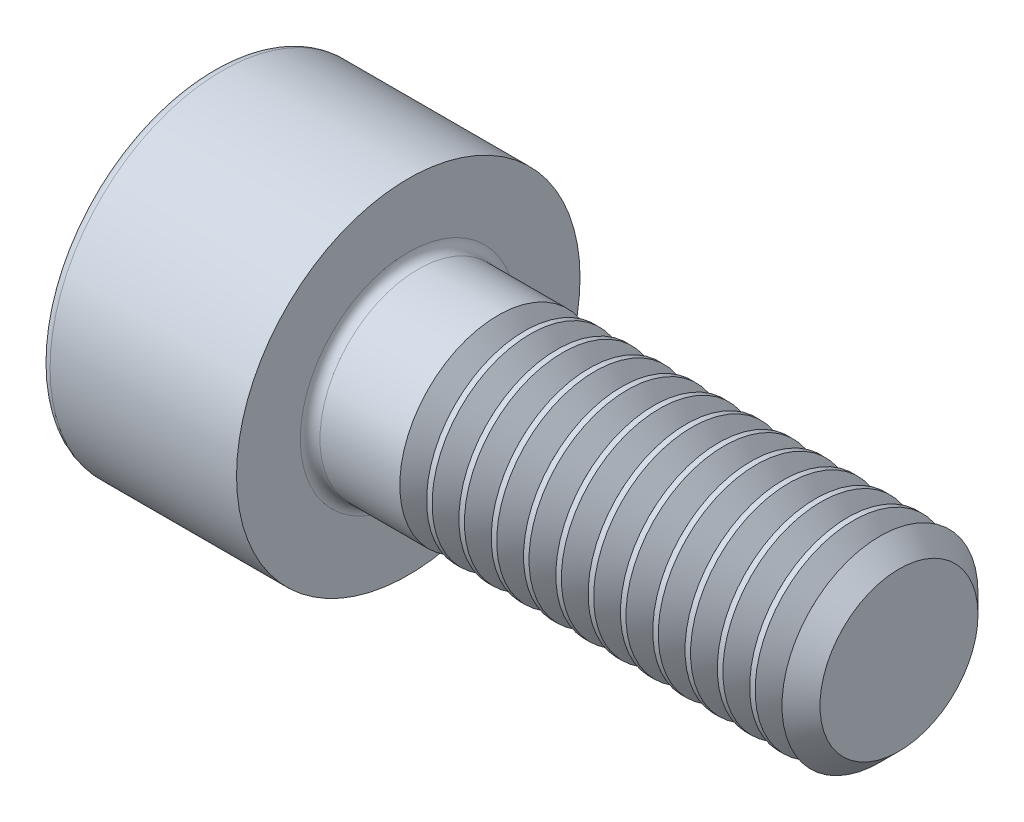
from build123d import *

# Parameters (mm, degrees)
SKETCH1_W            = 4
SKETCH1_H            = 3.5
SKETCH2_R            = 2
BOSS_EXTRUDE1_DEPTH  = 1.82691906
SKETCH3_R            = 2
BOSS_EXTRUDE2_DEPTH  = 0.27308094
BOSS_EXTRUDE2_TAPER  = 55
SKETCH4_R            = 1.61
BOSS_EXTRUDE3_DEPTH  = 0.27308094
BOSS_EXTRUDE3_DRAFT  = -55
SKETCH5_R            = 2
BOSS_EXTRUDE4_DEPTH  = 0.112171454
SKETCH6_R            = 2
BOSS_EXTRUDE5_DEPTH  = 0.27308094
BOSS_EXTRUDE5_TAPER  = 55
SKETCH7_R            = 1.61
BOSS_EXTRUDE6_DEPTH  = 0.27308094
BOSS_EXTRUDE6_DRAFT  = -55
SKETCH8_R            = 2
BOSS_EXTRUDE7_DEPTH  = 0.112171454
SKETCH9_R            = 2
BOSS_EXTRUDE8_DEPTH  = 0.27308094
BOSS_EXTRUDE8_TAPER  = 55
SKETCH10_R           = 1.61
BOSS_EXTRUDE9_DEPTH  = 0.27308094
BOSS_EXTRUDE9_DRAFT  = -55
SKETCH11_R           = 2
BOSS_EXTRUDE10_DEPTH = 0.112171454
SKETCH12_R           = 2
BOSS_EXTRUDE11_DEPTH = 0.27308094
BOSS_EXTRUDE11_TAPER = 55
SKETCH13_R           = 1.61
BOSS_EXTRUDE12_DEPTH = 0.27308094
BOSS_EXTRUDE12_DRAFT = -55
SKETCH14_R           = 2
BOSS_EXTRUDE13_DEPTH = 0.112171454
SKETCH15_R           = 2
BOSS_EXTRUDE14_DEPTH = 0.27308094
BOSS_EXTRUDE14_TAPER = 55
SKETCH16_R           = 1.61
BOSS_EXTRUDE15_DEPTH = 0.27308094
BOSS_EXTRUDE15_DRAFT = -55
SKETCH17_R           = 2
BOSS_EXTRUDE16_DEPTH = 0.112171454
SKETCH18_R           = 2
BOSS_EXTRUDE17_DEPTH = 0.27308094
BOSS_EXTRUDE17_TAPER = 55
SKETCH19_R           = 1.61
BOSS_EXTRUDE18_DEPTH = 0.27308094
BOSS_EXTRUDE18_DRAFT = -55
SKETCH20_R           = 2
BOSS_EXTRUDE19_DEPTH = 0.112171454
SKETCH21_R           = 2
BOSS_EXTRUDE20_DEPTH = 0.27308094
BOSS_EXTRUDE20_TAPER = 55
SKETCH22_R           = 1.61
BOSS_EXTRUDE21_DEPTH = 0.27308094
BOSS_EXTRUDE21_DRAFT = -55
SKETCH23_R           = 2
BOSS_EXTRUDE22_DEPTH = 0.112171454
SKETCH24_R           = 2
BOSS_EXTRUDE23_DEPTH = 0.27308094
BOSS_EXTRUDE23_TAPER = 55
SKETCH25_R           = 1.61
BOSS_EXTRUDE24_DEPTH = 0.27308094
BOSS_EXTRUDE24_DRAFT = -55
SKETCH26_R           = 2
BOSS_EXTRUDE25_DEPTH = 0.112171454
SKETCH27_R           = 2
BOSS_EXTRUDE26_DEPTH = 0.27308094
BOSS_EXTRUDE26_TAPER = 55
SKETCH28_R           = 1.61
BOSS_EXTRUDE27_DEPTH = 0.27308094
BOSS_EXTRUDE27_DRAFT = -55
SKETCH29_R           = 2
BOSS_EXTRUDE28_DEPTH = 0.112171454
SKETCH30_R           = 2
BOSS_EXTRUDE29_DEPTH = 0.27308094
BOSS_EXTRUDE29_TAPER = 55
SKETCH31_R           = 1.61
BOSS_EXTRUDE30_DEPTH = 0.27308094
BOSS_EXTRUDE30_DRAFT = -55
SKETCH32_R           = 2
BOSS_EXTRUDE31_DEPTH = 0.112171454
SKETCH33_R           = 2
BOSS_EXTRUDE32_DEPTH = 0.27308094
BOSS_EXTRUDE32_TAPER = 55
SKETCH34_R           = 1.61
BOSS_EXTRUDE33_DEPTH = 0.27308094
BOSS_EXTRUDE33_DRAFT = -55
SKETCH35_R           = 2
BOSS_EXTRUDE34_DEPTH = 0.112171454
SKETCH36_R           = 2
BOSS_EXTRUDE35_DEPTH = 0.27308094
BOSS_EXTRUDE35_TAPER = 55
SKETCH37_R           = 1.61
BOSS_EXTRUDE36_DEPTH = 0.271125702
BOSS_EXTRUDE36_DRAFT = -55
SKETCH38_R           = 1.997207631
BOSS_EXTRUDE37_DEPTH = 0.387207631
BOSS_EXTRUDE37_TAPER = 45
CUT_EXTRUDE1_DEPTH   = 2
FILLET1_R            = 0.2


with BuildPart() as part:
    # Sketch1 → Revolve1 (revolve)
    with BuildSketch(Plane(origin=(0, 0, 0), x_dir=(-1, 0, 0), z_dir=(0, 0, -1)), mode=Mode.PRIVATE) as revolve1_sk:
        with Locations((6.682284139, 1.899382545)):
            Rectangle(SKETCH1_W, SKETCH1_H)
    revolve(revolve1_sk.sketch.rotate(Axis((-4.682284139, 0.149382545, 0), (-1, 0, 0)), 270), axis=Axis((-4.682284139, 0.149382545, 0), (-1, 0, 0)))

    # Sketch2 → Boss-Extrude1 (add)
    with BuildSketch(Plane(origin=(-4.682284139, 0, 0), x_dir=(0, 0, -1), z_dir=(1, 0, 0))):
        with Locations((0, 0.149382545)):
            Circle(SKETCH2_R)
    extrude(amount=BOSS_EXTRUDE1_DEPTH)

    # Sketch3 → Boss-Extrude2 (add)
    with BuildSketch(Plane(origin=(-2.855365079, 0, 0), x_dir=(0, 0, -1), z_dir=(1, 0, 0))):
        with Locations((0, 0.149382545)):
            Circle(SKETCH3_R)
    extrude(amount=BOSS_EXTRUDE2_DEPTH, taper=BOSS_EXTRUDE2_TAPER)


with BuildPart() as boss_extrude3_tool:
    # Sketch4 → Boss-Extrude3 (with draft: the straight prism first)
    with BuildSketch(Plane(origin=(-2.582284139, 0, 0), x_dir=(0, 0, -1), z_dir=(1, 0, 0))):
        with Locations((0, 0.149382545)):
            Circle(SKETCH4_R)
    extrude(amount=BOSS_EXTRUDE3_DEPTH)
    # Boss-Extrude3: the draft: its side faces are tilted about the plane it starts from
    boss_extrude3_sides = [boss_extrude3_tool.faces().sort_by_distance(p)[0] for p in [
        (-2.445743669, 0.149382545, 1.61),
    ]]
    draft(boss_extrude3_sides, Plane(origin=(-2.582284139, 0, 0), x_dir=(0, 0, -1), z_dir=(1, 0, 0)), BOSS_EXTRUDE3_DRAFT)


with BuildPart() as part_1:
    add(part.part)

    # Boss-Extrude3: add boss_extrude3_tool
    add(boss_extrude3_tool.part)

    # Sketch5 → Boss-Extrude4 (add)
    with BuildSketch(Plane(origin=(-2.309203199, 0, 0), x_dir=(0, 0, -1), z_dir=(1, 0, 0))):
        with Locations((0, 0.149382545)):
            Circle(SKETCH5_R)
    extrude(amount=BOSS_EXTRUDE4_DEPTH)

    # Sketch6 → Boss-Extrude5 (add)
    with BuildSketch(Plane(origin=(-2.197031746, 0, 0), x_dir=(0, 0, -1), z_dir=(1, 0, 0))):
        with Locations((0, 0.149382545)):
            Circle(SKETCH6_R)
    extrude(amount=BOSS_EXTRUDE5_DEPTH, taper=BOSS_EXTRUDE5_TAPER)


with BuildPart() as boss_extrude6_tool:
    # Sketch7 → Boss-Extrude6 (with draft: the straight prism first)
    with BuildSketch(Plane(origin=(-1.923950806, 0, 0), x_dir=(0, 0, -1), z_dir=(1, 0, 0))):
        with Locations((0, 0.149382545)):
            Circle(SKETCH7_R)
    extrude(amount=BOSS_EXTRUDE6_DEPTH)
    # Boss-Extrude6: the draft: its side faces are tilted about the plane it starts from
    boss_extrude6_sides = [boss_extrude6_tool.faces().sort_by_distance(p)[0] for p in [
        (-1.787410336, 0.149382545, 1.61),
    ]]
    draft(boss_extrude6_sides, Plane(origin=(-1.923950806, 0, 0), x_dir=(0, 0, -1), z_dir=(1, 0, 0)), BOSS_EXTRUDE6_DRAFT)


with BuildPart() as part_2:
    add(part_1.part)

    # Boss-Extrude6: add boss_extrude6_tool
    add(boss_extrude6_tool.part)

    # Sketch8 → Boss-Extrude7 (add)
    with BuildSketch(Plane(origin=(-1.650869866, 0, 0), x_dir=(0, 0, -1), z_dir=(1, 0, 0))):
        with Locations((0, 0.149382545)):
            Circle(SKETCH8_R)
    extrude(amount=BOSS_EXTRUDE7_DEPTH)

    # Sketch9 → Boss-Extrude8 (add)
    with BuildSketch(Plane(origin=(-1.538698412, 0, 0), x_dir=(0, 0, -1), z_dir=(1, 0, 0))):
        with Locations((0, 0.149382545)):
            Circle(SKETCH9_R)
    extrude(amount=BOSS_EXTRUDE8_DEPTH, taper=BOSS_EXTRUDE8_TAPER)


with BuildPart() as boss_extrude9_tool:
    # Sketch10 → Boss-Extrude9 (with draft: the straight prism first)
    with BuildSketch(Plane(origin=(-1.265617472, 0, 0), x_dir=(0, 0, -1), z_dir=(1, 0, 0))):
        with Locations((0, 0.149382545)):
            Circle(SKETCH10_R)
    extrude(amount=BOSS_EXTRUDE9_DEPTH)
    # Boss-Extrude9: the draft: its side faces are tilted about the plane it starts from
    boss_extrude9_sides = [boss_extrude9_tool.faces().sort_by_distance(p)[0] for p in [
        (-1.129077002, 0.149382545, 1.61),
    ]]
    draft(boss_extrude9_sides, Plane(origin=(-1.265617472, 0, 0), x_dir=(0, 0, -1), z_dir=(1, 0, 0)), BOSS_EXTRUDE9_DRAFT)


with BuildPart() as part_3:
    add(part_2.part)

    # Boss-Extrude9: add boss_extrude9_tool
    add(boss_extrude9_tool.part)

    # Sketch11 → Boss-Extrude10 (add)
    with BuildSketch(Plane(origin=(-0.992536532, 0, 0), x_dir=(0, 0, -1), z_dir=(1, 0, 0))):
        with Locations((0, 0.149382545)):
            Circle(SKETCH11_R)
    extrude(amount=BOSS_EXTRUDE10_DEPTH)

    # Sketch12 → Boss-Extrude11 (add)
    with BuildSketch(Plane(origin=(-0.880365079, 0, 0), x_dir=(0, 0, -1), z_dir=(1, 0, 0))):
        with Locations((0, 0.149382545)):
            Circle(SKETCH12_R)
    extrude(amount=BOSS_EXTRUDE11_DEPTH, taper=BOSS_EXTRUDE11_TAPER)


with BuildPart() as boss_extrude12_tool:
    # Sketch13 → Boss-Extrude12 (with draft: the straight prism first)
    with BuildSketch(Plane(origin=(-0.607284139, 0, 0), x_dir=(0, 0, -1), z_dir=(1, 0, 0))):
        with Locations((0, 0.149382545)):
            Circle(SKETCH13_R)
    extrude(amount=BOSS_EXTRUDE12_DEPTH)
    # Boss-Extrude12: the draft: its side faces are tilted about the plane it starts from
    boss_extrude12_sides = [boss_extrude12_tool.faces().sort_by_distance(p)[0] for p in [
        (-0.470743669, 0.149382545, 1.61),
    ]]
    draft(boss_extrude12_sides, Plane(origin=(-0.607284139, 0, 0), x_dir=(0, 0, -1), z_dir=(1, 0, 0)), BOSS_EXTRUDE12_DRAFT)


with BuildPart() as part_4:
    add(part_3.part)

    # Boss-Extrude12: add boss_extrude12_tool
    add(boss_extrude12_tool.part)

    # Sketch14 → Boss-Extrude13 (add)
    with BuildSketch(Plane(origin=(-0.334203199, 0, 0), x_dir=(0, 0, -1), z_dir=(1, 0, 0))):
        with Locations((0, 0.149382545)):
            Circle(SKETCH14_R)
    extrude(amount=BOSS_EXTRUDE13_DEPTH)

    # Sketch15 → Boss-Extrude14 (add)
    with BuildSketch(Plane(origin=(-0.222031746, 0, 0), x_dir=(0, 0, -1), z_dir=(1, 0, 0))):
        with Locations((0, 0.149382545)):
            Circle(SKETCH15_R)
    extrude(amount=BOSS_EXTRUDE14_DEPTH, taper=BOSS_EXTRUDE14_TAPER)


with BuildPart() as boss_extrude15_tool:
    # Sketch16 → Boss-Extrude15 (with draft: the straight prism first)
    with BuildSketch(Plane(origin=(0.051049194, 0, 0), x_dir=(0, 0, -1), z_dir=(1, 0, 0))):
        with Locations((0, 0.149382545)):
            Circle(SKETCH16_R)
    extrude(amount=BOSS_EXTRUDE15_DEPTH)
    # Boss-Extrude15: the draft: its side faces are tilted about the plane it starts from
    boss_extrude15_sides = [boss_extrude15_tool.faces().sort_by_distance(p)[0] for p in [
        (0.187589664, 0.149382545, 1.61),
    ]]
    draft(boss_extrude15_sides, Plane(origin=(0.051049194, 0, 0), x_dir=(0, 0, -1), z_dir=(1, 0, 0)), BOSS_EXTRUDE15_DRAFT)


with BuildPart() as part_5:
    add(part_4.part)

    # Boss-Extrude15: add boss_extrude15_tool
    add(boss_extrude15_tool.part)

    # Sketch17 → Boss-Extrude16 (add)
    with BuildSketch(Plane(origin=(0.324130134, 0, 0), x_dir=(0, 0, -1), z_dir=(1, 0, 0))):
        with Locations((0, 0.149382545)):
            Circle(SKETCH17_R)
    extrude(amount=BOSS_EXTRUDE16_DEPTH)

    # Sketch18 → Boss-Extrude17 (add)
    with BuildSketch(Plane(origin=(0.436301588, 0, 0), x_dir=(0, 0, -1), z_dir=(1, 0, 0))):
        with Locations((0, 0.149382545)):
            Circle(SKETCH18_R)
    extrude(amount=BOSS_EXTRUDE17_DEPTH, taper=BOSS_EXTRUDE17_TAPER)


with BuildPart() as boss_extrude18_tool:
    # Sketch19 → Boss-Extrude18 (with draft: the straight prism first)
    with BuildSketch(Plane(origin=(0.709382528, 0, 0), x_dir=(0, 0, -1), z_dir=(1, 0, 0))):
        with Locations((0, 0.149382545)):
            Circle(SKETCH19_R)
    extrude(amount=BOSS_EXTRUDE18_DEPTH)
    # Boss-Extrude18: the draft: its side faces are tilted about the plane it starts from
    boss_extrude18_sides = [boss_extrude18_tool.faces().sort_by_distance(p)[0] for p in [
        (0.845922998, 0.149382545, 1.61),
    ]]
    draft(boss_extrude18_sides, Plane(origin=(0.709382528, 0, 0), x_dir=(0, 0, -1), z_dir=(1, 0, 0)), BOSS_EXTRUDE18_DRAFT)


with BuildPart() as part_6:
    add(part_5.part)

    # Boss-Extrude18: add boss_extrude18_tool
    add(boss_extrude18_tool.part)

    # Sketch20 → Boss-Extrude19 (add)
    with BuildSketch(Plane(origin=(0.982463468, 0, 0), x_dir=(0, 0, -1), z_dir=(1, 0, 0))):
        with Locations((0, 0.149382545)):
            Circle(SKETCH20_R)
    extrude(amount=BOSS_EXTRUDE19_DEPTH)

    # Sketch21 → Boss-Extrude20 (add)
    with BuildSketch(Plane(origin=(1.094634921, 0, 0), x_dir=(0, 0, -1), z_dir=(1, 0, 0))):
        with Locations((0, 0.149382545)):
            Circle(SKETCH21_R)
    extrude(amount=BOSS_EXTRUDE20_DEPTH, taper=BOSS_EXTRUDE20_TAPER)


with BuildPart() as boss_extrude21_tool:
    # Sketch22 → Boss-Extrude21 (with draft: the straight prism first)
    with BuildSketch(Plane(origin=(1.367715861, 0, 0), x_dir=(0, 0, -1), z_dir=(1, 0, 0))):
        with Locations((0, 0.149382545)):
            Circle(SKETCH22_R)
    extrude(amount=BOSS_EXTRUDE21_DEPTH)
    # Boss-Extrude21: the draft: its side faces are tilted about the plane it starts from
    boss_extrude21_sides = [boss_extrude21_tool.faces().sort_by_distance(p)[0] for p in [
        (1.504256331, 0.149382545, 1.61),
    ]]
    draft(boss_extrude21_sides, Plane(origin=(1.367715861, 0, 0), x_dir=(0, 0, -1), z_dir=(1, 0, 0)), BOSS_EXTRUDE21_DRAFT)


with BuildPart() as part_7:
    add(part_6.part)

    # Boss-Extrude21: add boss_extrude21_tool
    add(boss_extrude21_tool.part)

    # Sketch23 → Boss-Extrude22 (add)
    with BuildSketch(Plane(origin=(1.640796801, 0, 0), x_dir=(0, 0, -1), z_dir=(1, 0, 0))):
        with Locations((0, 0.149382545)):
            Circle(SKETCH23_R)
    extrude(amount=BOSS_EXTRUDE22_DEPTH)

    # Sketch24 → Boss-Extrude23 (add)
    with BuildSketch(Plane(origin=(1.752968254, 0, 0), x_dir=(0, 0, -1), z_dir=(1, 0, 0))):
        with Locations((0, 0.149382545)):
            Circle(SKETCH24_R)
    extrude(amount=BOSS_EXTRUDE23_DEPTH, taper=BOSS_EXTRUDE23_TAPER)


with BuildPart() as boss_extrude24_tool:
    # Sketch25 → Boss-Extrude24 (with draft: the straight prism first)
    with BuildSketch(Plane(origin=(2.026049194, 0, 0), x_dir=(0, 0, -1), z_dir=(1, 0, 0))):
        with Locations((0, 0.149382545)):
            Circle(SKETCH25_R)
    extrude(amount=BOSS_EXTRUDE24_DEPTH)
    # Boss-Extrude24: the draft: its side faces are tilted about the plane it starts from
    boss_extrude24_sides = [boss_extrude24_tool.faces().sort_by_distance(p)[0] for p in [
        (2.162589664, 0.149382545, 1.61),
    ]]
    draft(boss_extrude24_sides, Plane(origin=(2.026049194, 0, 0), x_dir=(0, 0, -1), z_dir=(1, 0, 0)), BOSS_EXTRUDE24_DRAFT)


with BuildPart() as part_8:
    add(part_7.part)

    # Boss-Extrude24: add boss_extrude24_tool
    add(boss_extrude24_tool.part)

    # Sketch26 → Boss-Extrude25 (add)
    with BuildSketch(Plane(origin=(2.299130134, 0, 0), x_dir=(0, 0, -1), z_dir=(1, 0, 0))):
        with Locations((0, 0.149382545)):
            Circle(SKETCH26_R)
    extrude(amount=BOSS_EXTRUDE25_DEPTH)

    # Sketch27 → Boss-Extrude26 (add)
    with BuildSketch(Plane(origin=(2.411301588, 0, 0), x_dir=(0, 0, -1), z_dir=(1, 0, 0))):
        with Locations((0, 0.149382545)):
            Circle(SKETCH27_R)
    extrude(amount=BOSS_EXTRUDE26_DEPTH, taper=BOSS_EXTRUDE26_TAPER)


with BuildPart() as boss_extrude27_tool:
    # Sketch28 → Boss-Extrude27 (with draft: the straight prism first)
    with BuildSketch(Plane(origin=(2.684382528, 0, 0), x_dir=(0, 0, -1), z_dir=(1, 0, 0))):
        with Locations((0, 0.149382545)):
            Circle(SKETCH28_R)
    extrude(amount=BOSS_EXTRUDE27_DEPTH)
    # Boss-Extrude27: the draft: its side faces are tilted about the plane it starts from
    boss_extrude27_sides = [boss_extrude27_tool.faces().sort_by_distance(p)[0] for p in [
        (2.820922998, 0.149382545, 1.61),
    ]]
    draft(boss_extrude27_sides, Plane(origin=(2.684382528, 0, 0), x_dir=(0, 0, -1), z_dir=(1, 0, 0)), BOSS_EXTRUDE27_DRAFT)


with BuildPart() as part_9:
    add(part_8.part)

    # Boss-Extrude27: add boss_extrude27_tool
    add(boss_extrude27_tool.part)

    # Sketch29 → Boss-Extrude28 (add)
    with BuildSketch(Plane(origin=(2.957463468, 0, 0), x_dir=(0, 0, -1), z_dir=(1, 0, 0))):
        with Locations((0, 0.149382545)):
            Circle(SKETCH29_R)
    extrude(amount=BOSS_EXTRUDE28_DEPTH)

    # Sketch30 → Boss-Extrude29 (add)
    with BuildSketch(Plane(origin=(3.069634921, 0, 0), x_dir=(0, 0, -1), z_dir=(1, 0, 0))):
        with Locations((0, 0.149382545)):
            Circle(SKETCH30_R)
    extrude(amount=BOSS_EXTRUDE29_DEPTH, taper=BOSS_EXTRUDE29_TAPER)


with BuildPart() as boss_extrude30_tool:
    # Sketch31 → Boss-Extrude30 (with draft: the straight prism first)
    with BuildSketch(Plane(origin=(3.342715861, 0, 0), x_dir=(0, 0, -1), z_dir=(1, 0, 0))):
        with Locations((0, 0.149382545)):
            Circle(SKETCH31_R)
    extrude(amount=BOSS_EXTRUDE30_DEPTH)
    # Boss-Extrude30: the draft: its side faces are tilted about the plane it starts from
    boss_extrude30_sides = [boss_extrude30_tool.faces().sort_by_distance(p)[0] for p in [
        (3.479256331, 0.149382545, 1.61),
    ]]
    draft(boss_extrude30_sides, Plane(origin=(3.342715861, 0, 0), x_dir=(0, 0, -1), z_dir=(1, 0, 0)), BOSS_EXTRUDE30_DRAFT)


with BuildPart() as part_10:
    add(part_9.part)

    # Boss-Extrude30: add boss_extrude30_tool
    add(boss_extrude30_tool.part)

    # Sketch32 → Boss-Extrude31 (add)
    with BuildSketch(Plane(origin=(3.615796801, 0, 0), x_dir=(0, 0, -1), z_dir=(1, 0, 0))):
        with Locations((0, 0.149382545)):
            Circle(SKETCH32_R)
    extrude(amount=BOSS_EXTRUDE31_DEPTH)

    # Sketch33 → Boss-Extrude32 (add)
    with BuildSketch(Plane(origin=(3.727968254, 0, 0), x_dir=(0, 0, -1), z_dir=(1, 0, 0))):
        with Locations((0, 0.149382545)):
            Circle(SKETCH33_R)
    extrude(amount=BOSS_EXTRUDE32_DEPTH, taper=BOSS_EXTRUDE32_TAPER)


with BuildPart() as boss_extrude33_tool:
    # Sketch34 → Boss-Extrude33 (with draft: the straight prism first)
    with BuildSketch(Plane(origin=(4.001049194, 0, 0), x_dir=(0, 0, -1), z_dir=(1, 0, 0))):
        with Locations((0, 0.149382545)):
            Circle(SKETCH34_R)
    extrude(amount=BOSS_EXTRUDE33_DEPTH)
    # Boss-Extrude33: the draft: its side faces are tilted about the plane it starts from
    boss_extrude33_sides = [boss_extrude33_tool.faces().sort_by_distance(p)[0] for p in [
        (4.137589664, 0.149382545, 1.61),
    ]]
    draft(boss_extrude33_sides, Plane(origin=(4.001049194, 0, 0), x_dir=(0, 0, -1), z_dir=(1, 0, 0)), BOSS_EXTRUDE33_DRAFT)


with BuildPart() as part_11:
    add(part_10.part)

    # Boss-Extrude33: add boss_extrude33_tool
    add(boss_extrude33_tool.part)

    # Sketch35 → Boss-Extrude34 (add)
    with BuildSketch(Plane(origin=(4.274130134, 0, 0), x_dir=(0, 0, -1), z_dir=(1, 0, 0))):
        with Locations((0, 0.149382545)):
            Circle(SKETCH35_R)
    extrude(amount=BOSS_EXTRUDE34_DEPTH)

    # Sketch36 → Boss-Extrude35 (add)
    with BuildSketch(Plane(origin=(4.386301588, 0, 0), x_dir=(0, 0, -1), z_dir=(1, 0, 0))):
        with Locations((0, 0.149382545)):
            Circle(SKETCH36_R)
    extrude(amount=BOSS_EXTRUDE35_DEPTH, taper=BOSS_EXTRUDE35_TAPER)


with BuildPart() as boss_extrude36_tool:
    # Sketch37 → Boss-Extrude36 (with draft: the straight prism first)
    with BuildSketch(Plane(origin=(4.659382528, 0, 0), x_dir=(0, 0, -1), z_dir=(1, 0, 0))):
        with Locations((0, 0.149382545)):
            Circle(SKETCH37_R)
    extrude(amount=BOSS_EXTRUDE36_DEPTH)
    # Boss-Extrude36: the draft: its side faces are tilted about the plane it starts from
    boss_extrude36_sides = [boss_extrude36_tool.faces().sort_by_distance(p)[0] for p in [
        (4.794945379, 0.149382545, 1.61),
    ]]
    draft(boss_extrude36_sides, Plane(origin=(4.659382528, 0, 0), x_dir=(0, 0, -1), z_dir=(1, 0, 0)), BOSS_EXTRUDE36_DRAFT)


with BuildPart() as part_12:
    add(part_11.part)

    # Boss-Extrude36: add boss_extrude36_tool
    add(boss_extrude36_tool.part)

    # Sketch38 → Boss-Extrude37 (add)
    with BuildSketch(Plane(origin=(4.93050823, 0, 0), x_dir=(0, 0, -1), z_dir=(1, 0, 0))):
        with Locations((0, 0.149382545)):
            Circle(SKETCH38_R)
    extrude(amount=BOSS_EXTRUDE37_DEPTH, taper=BOSS_EXTRUDE37_TAPER)

    # Sketch39 → Cut-Extrude1 (cut)
    with BuildSketch(Plane.ZY.offset(8.682284139)):
        Polygon((0, -1.623660131), (1.5355, -0.737138793), (1.5355, 1.035903884), (0, 1.922425222), (-1.5355, 1.035903884), (-1.5355, -0.737138793), align=None)
    extrude(amount=-CUT_EXTRUDE1_DEPTH, mode=Mode.SUBTRACT)

    # Sketch40 → Cut-Revolve1 (revolve, cut)
    with BuildSketch(Plane.XY, mode=Mode.PRIVATE) as cut_revolve1_sk:
        Polygon((-6.682284139, 1.684882545), (-6.682284139, 0.149382545), (-5.795762801, 0.149382545), align=None)
    revolve(cut_revolve1_sk.sketch.rotate(Axis((-6.682284139, 0.149382545, 0), (1, 0, 0)), 90), axis=Axis((-6.682284139, 0.149382545, 0), (1, 0, 0)), mode=Mode.SUBTRACT)

    # Fillet1
    fillet1_edges = [part_12.edges().sort_by_distance(p)[0] for p in [
        (-8.682284139, 0.149382545, -3.5),
        (-4.682284139, 0.149382545, 2),
    ]]
    fillet(fillet1_edges, radius=FILLET1_R)


solid = part_12.part
